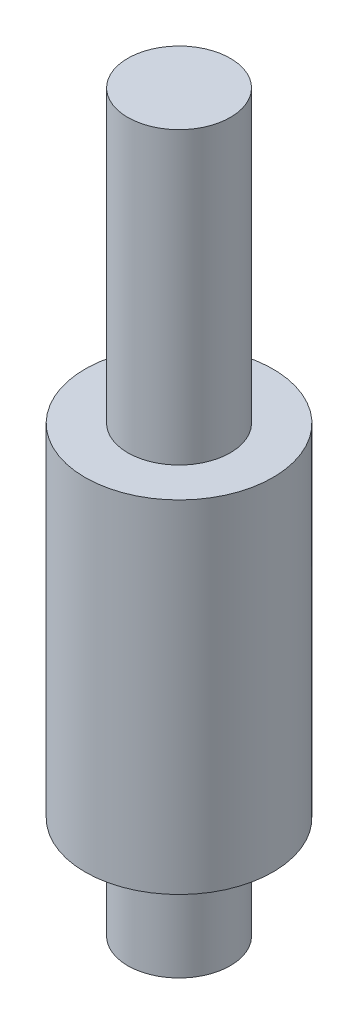
from build123d import *

# Parameters (mm, degrees)
SKETCH1_R           = 3
BOSS_EXTRUDE1_DEPTH = 6
SKETCH2_R           = 5.5
BOSS_EXTRUDE2_DEPTH = 20
SKETCH3_R           = 3
BOSS_EXTRUDE3_DEPTH = 17


with BuildPart() as part:
    # Sketch1 → Boss-Extrude1 (new body)
    with BuildSketch(Plane(origin=(0, 0, 0), x_dir=(1, 0, 0), z_dir=(0, 1, 0))):
        with Locations(Location((0, 0, 0), (0, 0, 270))):
            Circle(SKETCH1_R)
    extrude(amount=BOSS_EXTRUDE1_DEPTH)

    # Sketch2 → Boss-Extrude2 (add)
    with BuildSketch(Plane(origin=(0, 6, 0), x_dir=(1, 0, 0), z_dir=(0, 1, 0))):
        with Locations(Location((0, 0, 0), (0, 0, 270))):
            Circle(SKETCH2_R)
    extrude(amount=BOSS_EXTRUDE2_DEPTH)

    # Sketch3 → Boss-Extrude3 (add)
    with BuildSketch(Plane(origin=(0, 26, 0), x_dir=(1, 0, 0), z_dir=(0, 1, 0))):
        with Locations(Location((0, 0, 0), (0, 0, 270))):
            Circle(SKETCH3_R)
    extrude(amount=BOSS_EXTRUDE3_DEPTH)


solid = part.part
